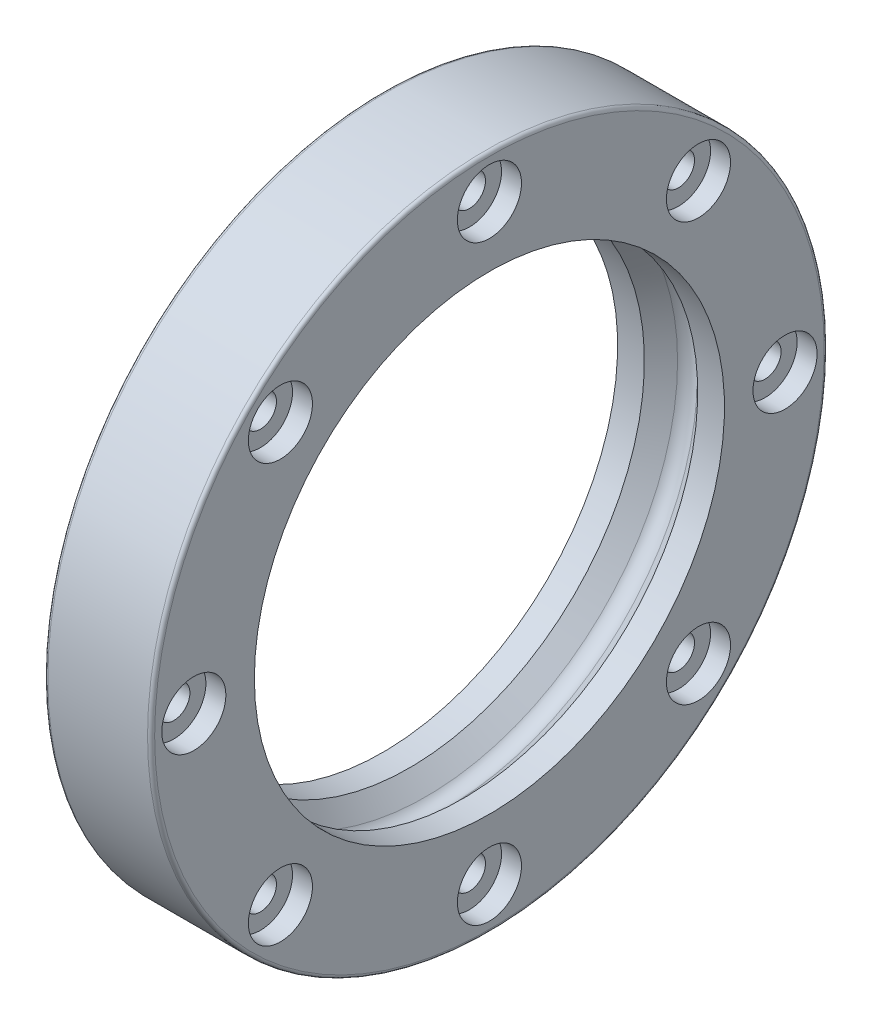
from build123d import *

# Parameters (mm, degrees)
FILLET1_R                                    = 2
FILLET2_R                                    = 0.5
CBORE_FOR_M4_HEX_HEAD_CAP_SCREW1_D           = 4.5
CBORE_FOR_M4_HEX_HEAD_CAP_SCREW1_CBORE_D     = 9
CBORE_FOR_M4_HEX_HEAD_CAP_SCREW1_CBORE_DEPTH = 2.8
CIRPATTERN1_COUNT                            = 8


with BuildPart() as part:
    # Sketch1 → Revolve1 (revolve)
    with BuildSketch(Plane.XY, mode=Mode.PRIVATE) as revolve1_sk:
        Polygon((-3.742640687, 33), (0, 36.742640687), (3.742640687, 33), (7.5, 33), (7.5, 47.5), (-7.5, 47.5), (-7.5, 33), align=None)
    revolve(revolve1_sk.sketch.rotate(Axis((-33.732241936, 0, 0), (1, 0, 0)), 90), axis=Axis((-33.732241936, 0, 0), (1, 0, 0)))

    # Fillet1
    fillet1_edges = [part.edges().sort_by_distance(p)[0] for p in [
        (0, 0, -36.742640687),
    ]]
    fillet(fillet1_edges, radius=FILLET1_R)

    # Fillet2
    fillet2_edges = [part.edges().sort_by_distance(p)[0] for p in [
        (-7.5, 0, -47.5),
        (7.5, 0, -47.5),
    ]]
    fillet(fillet2_edges, radius=FILLET2_R)

    # CBORE for M4 Hex Head Cap Screw1 (through all)
    with Locations(Plane(origin=(7.5, 41.5, 0), x_dir=(0, 0, 1), z_dir=(1, 0, 0))):
        with Locations((0, 0)):
            cbore_for_m4_hex_head_cap_screw1 = CounterBoreHole(CBORE_FOR_M4_HEX_HEAD_CAP_SCREW1_D / 2, CBORE_FOR_M4_HEX_HEAD_CAP_SCREW1_CBORE_D / 2, CBORE_FOR_M4_HEX_HEAD_CAP_SCREW1_CBORE_DEPTH)

    # CirPattern1: CBORE for M4 Hex Head Cap Screw1 ×8 about axis
    cirpattern1_axis = Axis((0, 0, 0), (1, 0, 0))
    for i in range(1, CIRPATTERN1_COUNT):
        add(cbore_for_m4_hex_head_cap_screw1.rotate(cirpattern1_axis, i * 360 / CIRPATTERN1_COUNT), mode=Mode.SUBTRACT)


solid = part.part
